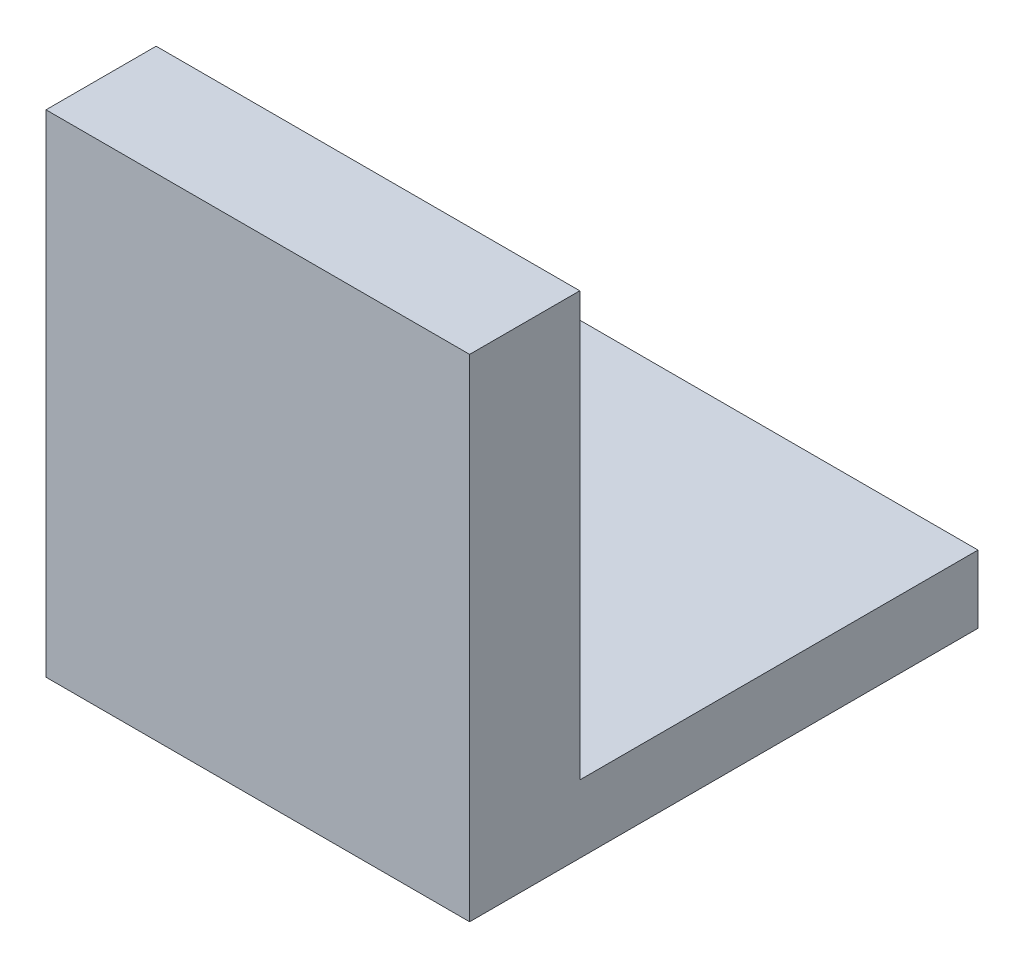
from build123d import *

# Parameters (mm, degrees)
SKETCH1_W           = 50
SKETCH1_H           = 60
BOSS_EXTRUDE1_DEPTH = 8
SKETCH2_W           = 50
SKETCH2_H           = 13
BOSS_EXTRUDE2_DEPTH = 50


with BuildPart() as part:
    # Sketch1 → Boss-Extrude1 (new body)
    with BuildSketch(Plane(origin=(0, 0, 0), x_dir=(1, 0, 0), z_dir=(0, 1, 0))):
        Rectangle(SKETCH1_W, SKETCH1_H)
    extrude(amount=BOSS_EXTRUDE1_DEPTH)

    # Sketch2 → Boss-Extrude2 (add)
    with BuildSketch(Plane(origin=(0, 8, 0), x_dir=(1, 0, 0), z_dir=(0, 1, 0))):
        with Locations((0, -23.5)):
            Rectangle(SKETCH2_W, SKETCH2_H)
    extrude(amount=BOSS_EXTRUDE2_DEPTH)


solid = part.part
